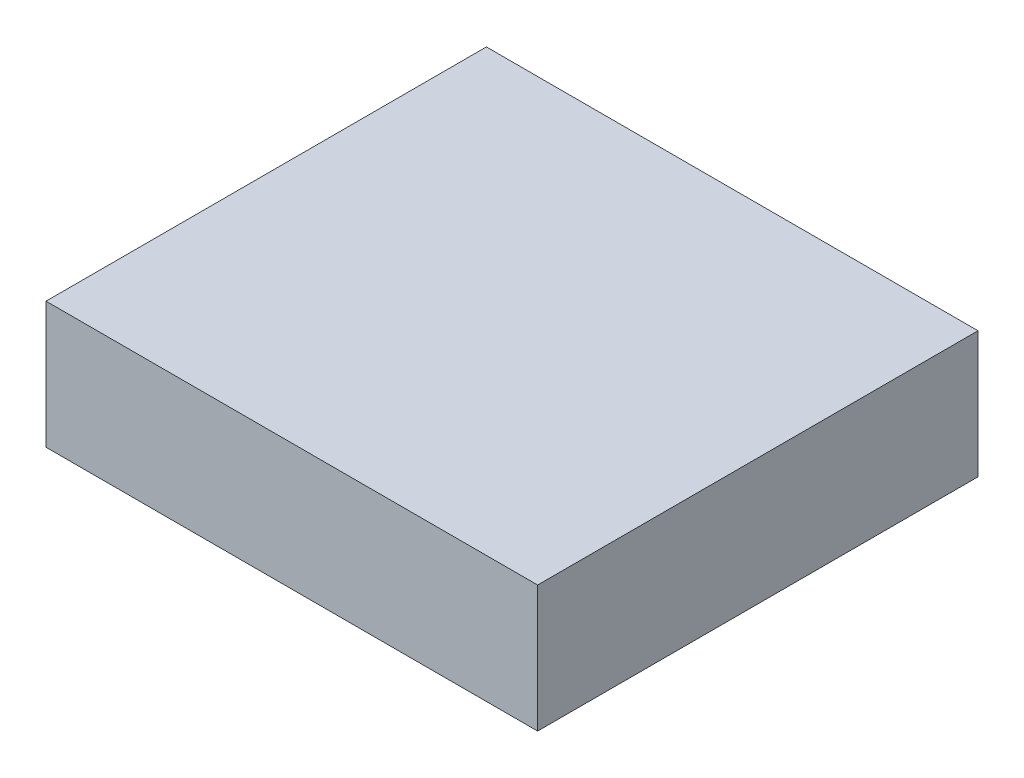
from build123d import *

# Parameters (mm, degrees)
SKETCH1_W           = 77.978
SKETCH1_H           = 69.85
BOSS_EXTRUDE1_DEPTH = 20.066


with BuildPart() as part:
    # Sketch1 → Boss-Extrude1 (new body)
    with BuildSketch(Plane(origin=(0, 0, 0), x_dir=(1, 0, 0), z_dir=(0, 1, 0))):
        with Locations((38.989, 34.925)):
            Rectangle(SKETCH1_W, SKETCH1_H)
    extrude(amount=BOSS_EXTRUDE1_DEPTH)


solid = part.part
